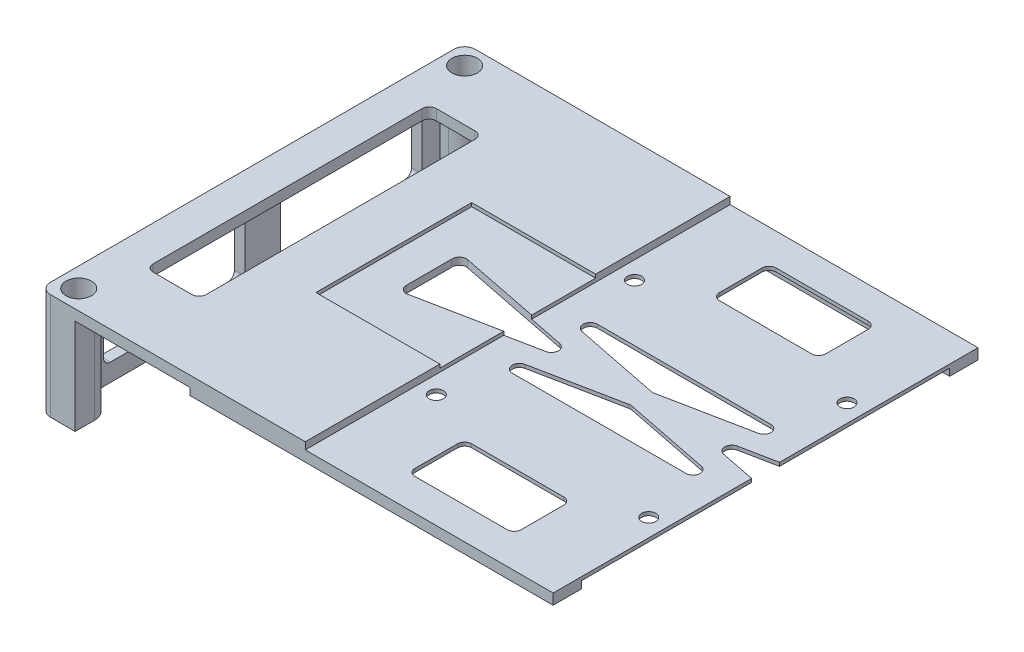
from build123d import *

# Parameters (mm, degrees)
SKETCH_8_W                = 220
SKETCH_8_H                = 120
EXTRUDE_6_DEPTH           = 3
SKETCH_10_W               = 10
SKETCH_10_H               = 120
EXTRUDE_7_DEPTH           = 27
CUT_EXTRUDE_1_DEPTH       = 129.175660716
CUT_EXTRUDE_1_DEPTH_BACK  = 129.175660716
SKETCH_9_R                = 2.05
SKETCH_11_R               = 3.6
CUT_EXTRUDE_2_DEPTH       = 22
CUT_EXTRUDE_4_DEPTH       = 129.175660716
CUT_EXTRUDE_4_DEPTH_BACK  = 129.175660716
SKETCH_13_W               = 40
SKETCH_13_H               = 18.5
SKETCH_14_W               = 140
SKETCH_14_H               = 44
CUT_EXTRUDE_7_DEPTH       = 1
SKETCH_15_W               = 15
SKETCH_15_H               = 80
SKETCH_15_H_2             = 40
SKETCH_15_W_2             = 30
SKETCH_15_H_3             = 16
CUT_EXTRUDE_8_DEPTH       = 129.840987267
SKETCH_9_5_R              = 2
CUT_EXTRUDE_9_DEPTH       = 129.175660716
CUT_EXTRUDE_13_DEPTH      = 27
SKETCH_20_W               = 135
SKETCH_20_H               = 8
EXTRUDE_8_DEPTH           = 2
FILLET_1_R                = 3
FILLET_2_R                = 2
CUT_EXTRUDE_14_DEPTH      = 129.175660716
CUT_EXTRUDE_14_DEPTH_BACK = 129.175660716


with BuildPart() as part:
    # 草圖8 → 填料-伸長6 (new body)
    with BuildSketch(Plane(origin=(0, 0, 0), x_dir=(1, 0, 0), z_dir=(0, 1, 0))):
        Rectangle(SKETCH_8_W, SKETCH_8_H)
    extrude(amount=EXTRUDE_6_DEPTH)

    # 草圖10 → 填料-伸長7 (add)
    with BuildSketch(Plane.XZ):
        with Locations((-105, 0)):
            Rectangle(SKETCH_10_W, SKETCH_10_H)
        with Locations((105, 0)):
            Rectangle(SKETCH_10_W, SKETCH_10_H)
    extrude(amount=EXTRUDE_7_DEPTH)

    # 草圖9 → 除料-伸長1 (cut, two sides: drawn at the far end of the back side and taken through both)
    with BuildSketch(Plane(origin=(0, 0, 0), x_dir=(1, 0, 0), z_dir=(0, 1, 0)).offset(-CUT_EXTRUDE_1_DEPTH_BACK)):
        with Locations((104.5, 54.5)):
            Circle(SKETCH_9_R)
        with Locations((-104.5, 54.5)):
            Circle(SKETCH_9_R)
        with Locations((-104.5, -54.5)):
            Circle(SKETCH_9_R)
        with Locations((104.5, -54.5)):
            Circle(SKETCH_9_R)
    extrude(amount=CUT_EXTRUDE_1_DEPTH + CUT_EXTRUDE_1_DEPTH_BACK, mode=Mode.SUBTRACT)

    # 草圖11 → 除料-伸長2 (cut)
    with BuildSketch(Plane(origin=(0, 3, 0), x_dir=(1, 0, 0), z_dir=(0, 1, 0))):
        with Locations((-104.497380754, 54.5)):
            Circle(SKETCH_11_R)
        with Locations((-104.497380754, -54.5)):
            Circle(SKETCH_11_R)
        with Locations((104.5, -54.5)):
            Circle(SKETCH_11_R)
        with Locations((104.5, 54.5)):
            Circle(SKETCH_11_R)
    extrude(amount=-CUT_EXTRUDE_2_DEPTH, mode=Mode.SUBTRACT)

    # 草圖13 → 除料-伸長4 (cut, two sides: drawn at the far end of the back side and taken through both)
    with BuildSketch(Plane(origin=(0, 0, 0), x_dir=(0, 0, -1), z_dir=(1, 0, 0)).offset(-CUT_EXTRUDE_4_DEPTH_BACK)):
        with Locations((-25, -12.75)):
            Rectangle(SKETCH_13_W, SKETCH_13_H)
        with Locations((25, -12.75)):
            Rectangle(SKETCH_13_W, SKETCH_13_H)
    extrude(amount=CUT_EXTRUDE_4_DEPTH + CUT_EXTRUDE_4_DEPTH_BACK, mode=Mode.SUBTRACT)

    # 草圖14 → 除料-伸長7 (cut)
    with BuildSketch(Plane(origin=(0, 3, 0), x_dir=(1, 0, 0), z_dir=(0, 1, 0))):
        Rectangle(SKETCH_14_W, SKETCH_14_H)
    extrude(amount=-CUT_EXTRUDE_7_DEPTH, mode=Mode.SUBTRACT)

    # 草圖15 → 除料-伸長8 (cut, through all)
    with BuildSketch(Plane(origin=(0, 3, 0), x_dir=(1, 0, 0), z_dir=(0, 1, 0))):
        with Locations((-92.5, 0)):
            Rectangle(SKETCH_15_W, SKETCH_15_H)
        with Locations((92.5, 25)):
            Rectangle(SKETCH_15_W, SKETCH_15_H_2)
        Polygon((-44.702941459, -12), (44.702941459, -12), (0, -3.059411708), align=None)
        Polygon((-60, -8.940588292), (-60, 8.940588292), (-15.297058541, 0), align=None)
        Polygon((-44.702941459, 12), (44.702941459, 12), (0, 3.059411708), align=None)
        Polygon((60, -8.940588292), (60, 8.940588292), (15.297058541, 0), align=None)
        with Locations((0, -43)):
            Rectangle(SKETCH_15_W_2, SKETCH_15_H_3)
        with Locations((0, 43)):
            Rectangle(SKETCH_15_W_2, SKETCH_15_H_3)
        with Locations((92.5, -25)):
            Rectangle(SKETCH_15_W, SKETCH_15_H_2)
    extrude(amount=-CUT_EXTRUDE_8_DEPTH, mode=Mode.SUBTRACT)

    # 草圖9<5> → 除料-伸長9 (cut, through all)
    with BuildSketch(Plane(origin=(0, 0, 0), x_dir=(1, 0, 0), z_dir=(0, 1, 0))):
        with Locations((30, 28)):
            Circle(SKETCH_9_5_R)
        with Locations((-30, 28)):
            Circle(SKETCH_9_5_R)
        with Locations((30, -28)):
            Circle(SKETCH_9_5_R)
        with Locations((-30, -28)):
            Circle(SKETCH_9_5_R)
    extrude(amount=CUT_EXTRUDE_9_DEPTH, mode=Mode.SUBTRACT)

    # 草圖19 → 除料-伸長13 (cut)
    with BuildSketch(Plane.XZ.offset(27)):
        with BuildLine():
            Line((-100, 54.5), (-100, -54.5))
            ThreePointArc((-100, -54.5), (-101.318019485, -51.318019485), (-104.5, -50))
            Line((-104.5, -50), (-107, -50))
            Line((-107, -50), (-107, 50))
            Line((-107, 50), (-104.5, 50))
            ThreePointArc((-104.5, 50), (-101.318019485, 51.318019485), (-100, 54.5))
        make_face()
        with BuildLine():
            Line((100, 54.5), (100, -54.5))
            ThreePointArc((100, -54.5), (101.318019485, -51.318019485), (104.5, -50))
            Line((104.5, -50), (107, -50))
            Line((107, -50), (107, 50))
            Line((107, 50), (104.5, 50))
            ThreePointArc((104.5, 50), (101.318019485, 51.318019485), (100, 54.5))
        make_face()
    extrude(amount=-CUT_EXTRUDE_13_DEPTH, mode=Mode.SUBTRACT)

    # 草圖20 → 填料-伸長8 (add)
    with BuildSketch(Plane.XZ):
        with Locations((0, 56)):
            Rectangle(SKETCH_20_W, SKETCH_20_H)
        with Locations((0, -56)):
            Rectangle(SKETCH_20_W, SKETCH_20_H)
        Polygon((-59, 32.5), (-39, 32.5), (-39, 29.5), (-54, 29.5), (-54, 25), (-59, 25), align=None)
        Polygon((54, 29.5), (39, 29.5), (39, 32.5), (59, 32.5), (59, 25), (54, 25), align=None)
        Polygon((59, -32.5), (39, -32.5), (39, -29.5), (54, -29.5), (54, -25), (59, -25), align=None)
        Polygon((-54, -29.5), (-39, -29.5), (-39, -32.5), (-59, -32.5), (-59, -25), (-54, -25), align=None)
    extrude(amount=EXTRUDE_8_DEPTH)

    # 圓角1
    fillet_1_edges = [part.edges().sort_by_distance(p)[0] for p in [
        (-110, -12, 60),
        (-110, -12, -60),
        (110, -12, -60),
        (110, -12, 60),
    ]]
    fillet(fillet_1_edges, radius=FILLET_1_R)

    # 圓角2
    fillet_2_edges = [part.edges().sort_by_distance(p)[0] for p in [
        (-107, 0, 0),
        (107, 0, 0),
        (108.5, -3.5, -5),
        (108.5, -3.5, 45),
        (108.5, -22, 45),
        (108.5, -22, -5),
        (108.5, -3.5, -45),
        (108.5, -3.5, 5),
        (108.5, -22, 5),
        (108.5, -22, -45),
        (-108.5, -22, -45),
        (-108.5, -22, 5),
        (-108.5, -3.5, -45),
        (-108.5, -3.5, 5),
        (-108.5, -22, 45),
        (-108.5, -3.5, 45),
        (-108.5, -3.5, -5),
        (-108.5, -22, -5),
        (60, 1, -8.940588292),
        (44.702941459, 1, -12),
        (-44.702941459, 1, -12),
        (0, 1, 3.059411708),
        (-44.702941459, 1, 12),
        (44.702941459, 1, 12),
        (-15.297058541, 1, 0),
        (0, 1, -3.059411708),
        (60, 1, 8.940588292),
        (100, 1.5, -5),
        (15, 1.5, -35),
        (100, 1.5, 45),
        (15, 1.5, 51),
        (-85, 1.5, 40),
        (-15, 1.5, 51),
        (85, 1.5, -5),
        (15.297058541, 1, 0),
        (-100, 1.5, 40),
        (-15, 1.5, -35),
        (-60, 1, 8.940588292),
        (-60, 1, -8.940588292),
        (15, 1.5, 35),
        (-15, 1.5, 35),
        (85, 1.5, 5),
        (85, 1.5, -45),
        (100, 1.5, 5),
        (100, 1.5, -45),
        (15, 1.5, -51),
        (-15, 1.5, -51),
        (-85, 1.5, -40),
        (-100, 1.5, -40),
    ]]
    fillet(fillet_2_edges, radius=FILLET_2_R)

    # 草圖21 → 除料-伸長14 (cut, two sides: drawn at the far end of the back side and taken through both)
    with BuildSketch(Plane.XY.offset(-CUT_EXTRUDE_14_DEPTH_BACK)):
        Polygon((110, 3), (-35, 3), (-35, 1), (35, 1), (35, -27), (110, -27), align=None)
    extrude(amount=CUT_EXTRUDE_14_DEPTH + CUT_EXTRUDE_14_DEPTH_BACK, mode=Mode.SUBTRACT)


solid = part.part
